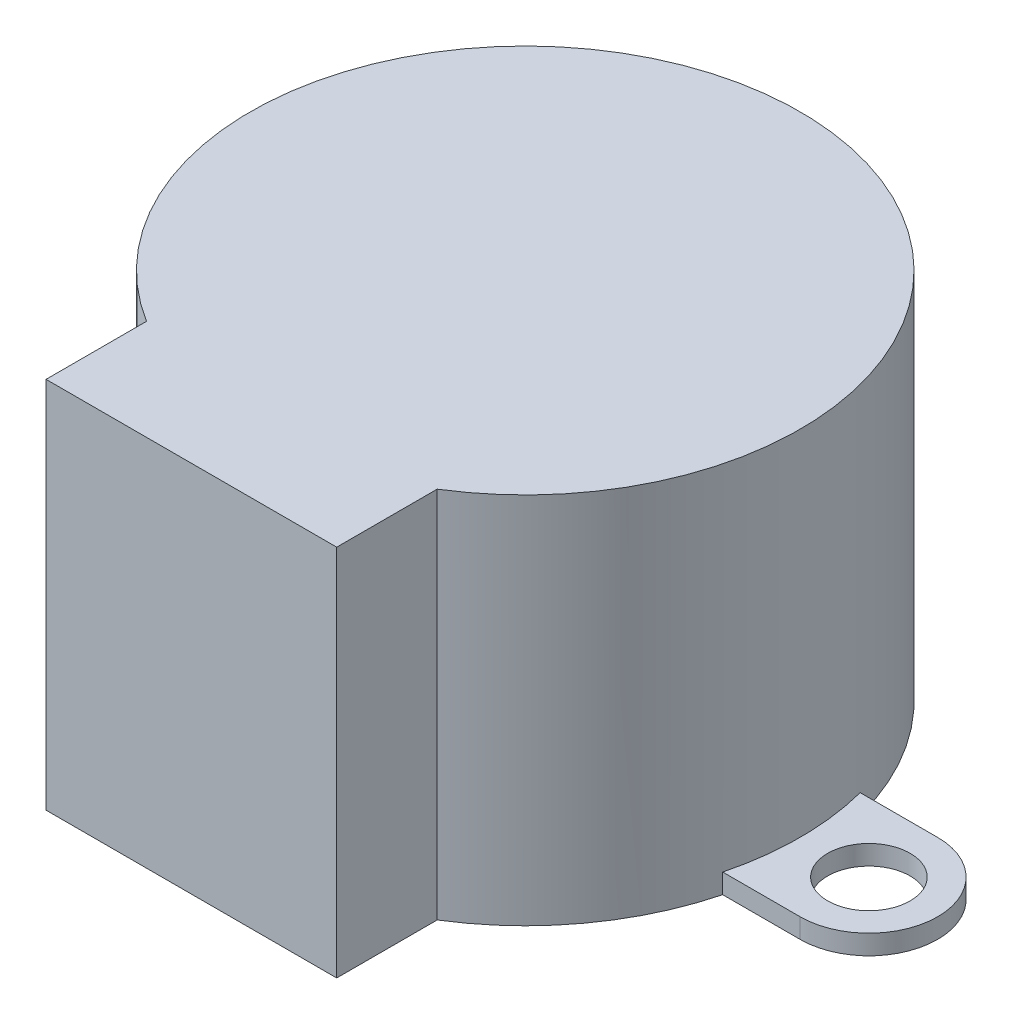
from build123d import *
from build123d.topology import SkipClean

# Parameters (mm, degrees)
BOSS_EXTRUDE1_DEPTH = 19
SKETCH2_R           = 2.1
BOSS_EXTRUDE2_DEPTH = 1
SKETCH3_R           = 4.5
BOSS_EXTRUDE3_DEPTH = 1.5
SKETCH4_R           = 2.5
BOSS_EXTRUDE4_DEPTH = 2.5
BOSS_EXTRUDE5_DEPTH = 6


with BuildPart() as part:
    # Sketch1 → Boss-Extrude1 (new body)
    with BuildSketch(Plane(origin=(0, 0, 0), x_dir=(1, 0, 0), z_dir=(0, 1, 0))):
        with BuildLine():
            Line((-7.4, -17), (-7.4, -11.884443613))
            ThreePointArc((-7.4, -11.884443613), (0, 14), (7.4, -11.884443613))
            Line((7.4, -11.884443613), (7.4, -17))
            Line((7.4, -17), (-7.4, -17))
        make_face()
    extrude(amount=BOSS_EXTRUDE1_DEPTH)

    # Sketch2 → Boss-Extrude2 (add)
    # profile 1 of 2: a face of its own
    with BuildSketch(Plane.XZ):
        with BuildLine():
            Line((13.555441712, -3.5), (13.555441712, 3.5))
            Line((13.555441712, 3.5), (17.5, 3.5))
            ThreePointArc((17.5, 3.5), (21, 0), (17.5, -3.5))
            Line((17.5, -3.5), (13.555441712, -3.5))
        make_face()
        with Locations(Location((17.5, 0, 0), (0, 0, 90))):
            Circle(SKETCH2_R, mode=Mode.SUBTRACT)
    # profile 2 of 2: a face of its own
    with BuildSketch(Plane.XZ):
        with BuildLine():
            Line((-17.5, -3.5), (-13.555441712, -3.5))
            Line((-13.555441712, -3.5), (-13.555441712, 3.5))
            Line((-13.555441712, 3.5), (-17.5, 3.5))
            ThreePointArc((-17.5, 3.5), (-21, 0), (-17.5, -3.5))
        make_face()
        with Locations(Location((-17.5, 0, 0), (0, 0, 270))):
            Circle(SKETCH2_R, mode=Mode.SUBTRACT)
    extrude(amount=-BOSS_EXTRUDE2_DEPTH)

    # Sketch3 → Boss-Extrude3 (add)
    with BuildSketch(Plane.XZ):
        with Locations(Location((0, -8, 0), (0, 0, 90))):
            Circle(SKETCH3_R)
    extrude(amount=BOSS_EXTRUDE3_DEPTH)

    # Sketch4 → Boss-Extrude4 (add)
    with BuildSketch(Plane.XZ.offset(1.5)):
        with Locations(Location((0, -8, 0), (0, 0, 270))):
            Circle(SKETCH4_R)
    extrude(amount=BOSS_EXTRUDE4_DEPTH)

    # Sketch5 → Boss-Extrude5 (add)
    with SkipClean():  # the faces are left unmerged after this step: merging them gives an invalid solid
        with BuildSketch(Plane.XZ.offset(4)):
            with BuildLine():
                Line((-1.5, -10), (-1.5, -6))
                ThreePointArc((-1.5, -6), (0, -5.5), (1.5, -6))
                Line((1.5, -6), (1.5, -10))
                ThreePointArc((1.5, -10), (0, -10.5), (-1.5, -10))
            make_face()
        extrude(amount=BOSS_EXTRUDE5_DEPTH)


solid = part.part
